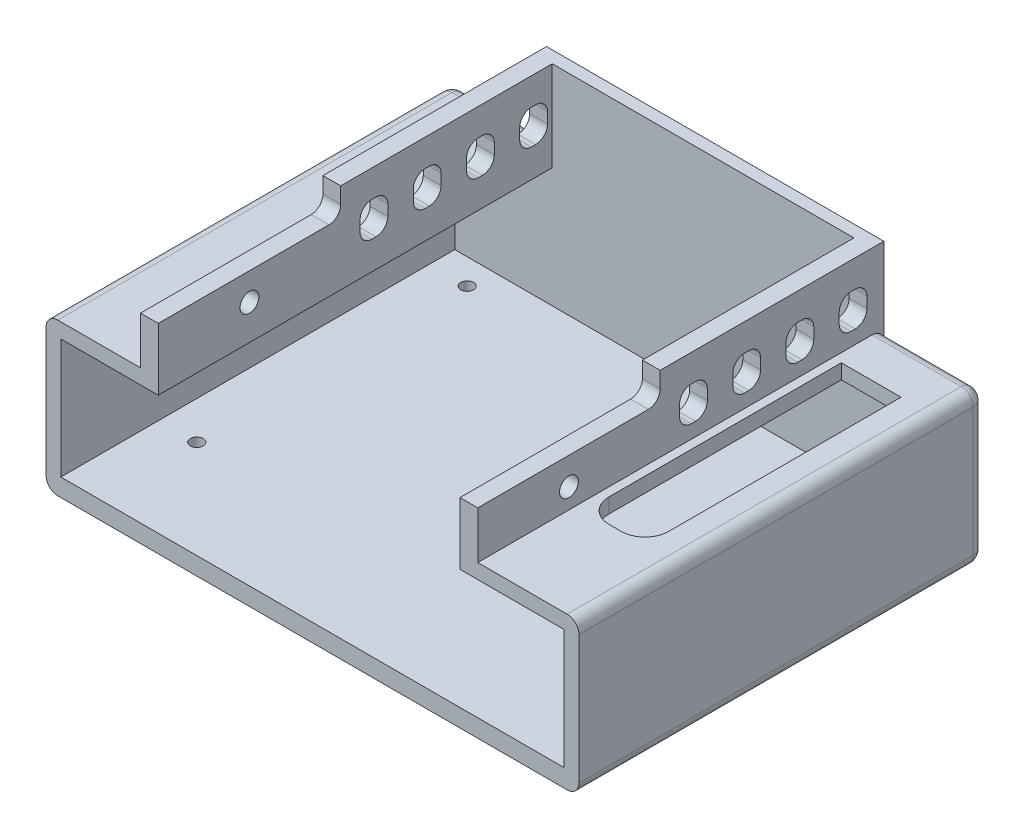
from build123d import *

# Parameters (mm, degrees)
BOSS_EXTRUDE2_DEPTH     = 25.654
BOSS_EXTRUDE4_DEPTH     = 3.175
BOSS_EXTRUDE5_DEPTH     = 16.141204421
CUT_EXTRUDE1_DEPTH      = 36.068
CUT_EXTRUDE1_DEPTH_BACK = 99.314
SKETCH8_W               = 5.954134369
SKETCH8_H               = 7.391339216
SKETCH8_3_W             = 5.954134368
SKETCH8_3_H             = 7.391339216
SKETCH8_3_W_2           = 5.954134369
CUT_EXTRUDE2_DEPTH      = 99.314
SKETCH10_W              = 114.3
SKETCH10_H              = 87.072843295
BOSS_EXTRUDE7_DEPTH     = 3.81
SKETCH11_W              = 12.814534476
SKETCH11_H              = 54.915455345
CUT_EXTRUDE4_DEPTH      = 23.368
SKETCH18_W              = 3.81
SKETCH18_H              = 39.122149616
BOSS_EXTRUDE10_DEPTH    = 10.16
CUT_EXTRUDE5_DEPTH      = 33.528
CUT_EXTRUDE5_DEPTH_BACK = 93.218
SKETCH20_R              = 2.0193
CUT_EXTRUDE7_REACH      = 108.861
SKETCH21_R              = 1.375
FILLET1_R               = 2.54
FILLET2_R               = 2.54
FILLET3_R               = 2.54
FILLET4_R               = 5.08


with BuildPart() as part:
    # Sketch1 → Boss-Extrude2 (new body)
    with BuildSketch(Plane(origin=(0, 0, 0), x_dir=(1, 0, 0), z_dir=(0, 1, 0))):
        Polygon((29.891415821, 47.667452431), (-84.408584179, 47.667452431), (-84.408584179, -39.405390864), (-81.233584179, -39.405390864), (-81.233584179, 45.081669174), (26.716415821, 45.081669174), (26.716415821, -39.405390864), (29.891415821, -39.405390864), align=None)
    extrude(amount=BOSS_EXTRUDE2_DEPTH)

    # Sketch3 → Boss-Extrude4 (add)
    with BuildSketch(Plane(origin=(0, 25.654, 0), x_dir=(1, 0, 0), z_dir=(0, 1, 0))):
        Polygon((29.891415821, 47.667452431), (-84.408584179, 47.667452431), (-84.408584179, -39.405390864), (-60.331822089, -39.405390864), (-60.331822089, 45.081669174), (4.379625861, 45.081669174), (4.379625861, -39.405390864), (29.891415821, -39.405390864), align=None)
    extrude(amount=BOSS_EXTRUDE4_DEPTH)

    # Sketch4 → Boss-Extrude5 (add)
    with BuildSketch(Plane(origin=(0, 28.829, 0), x_dir=(1, 0, 0), z_dir=(0, 1, 0))):
        Polygon((-64.141822089, -0.283241248), (-60.331822089, -0.283241248), (-60.331822089, 45.081669174), (4.379625861, 45.081669174), (4.379625861, -0.283241248), (8.189625861, -0.283241248), (8.189625861, 47.667452431), (-64.141822089, 47.667452431), align=None)
    extrude(amount=BOSS_EXTRUDE5_DEPTH)

    # Sketch8 → Cut-Extrude1 (cut, two sides: drawn at the far end of the back side and taken through both)
    with BuildSketch(Plane(origin=(8.189625861, 0, 0), x_dir=(0, 0, -1), z_dir=(1, 0, 0)).offset(-CUT_EXTRUDE1_DEPTH_BACK)):
        with Locations((18.262175985, 35.424269821)):
            Rectangle(SKETCH8_W, SKETCH8_H)
    extrude(amount=CUT_EXTRUDE1_DEPTH + CUT_EXTRUDE1_DEPTH_BACK, mode=Mode.SUBTRACT)

    # Sketch8<3> → Cut-Extrude2 (cut)
    with BuildSketch(Plane(origin=(8.189625861, 0, 0), x_dir=(0, 0, -1), z_dir=(1, 0, 0))):
        with Locations((41.087726864, 35.434837043)):
            Rectangle(SKETCH8_3_W, SKETCH8_3_H)
        with Locations((29.674951425, 35.429553432)):
            Rectangle(SKETCH8_3_W_2, SKETCH8_3_H)
        with Locations((18.262175985, 35.424269821)):
            Rectangle(SKETCH8_3_W_2, SKETCH8_3_H)
        with Locations((6.849400545, 35.41898621)):
            Rectangle(SKETCH8_3_W, SKETCH8_3_H)
    extrude(amount=-CUT_EXTRUDE2_DEPTH, mode=Mode.SUBTRACT)

    # Sketch10 → Boss-Extrude7 (add)
    with BuildSketch(Plane(origin=(0, 0, 0), x_dir=(1, 0, 0), z_dir=(0, 1, 0))):
        with Locations((-27.258584179, 4.131030783)):
            Rectangle(SKETCH10_W, SKETCH10_H)
    extrude(amount=-BOSS_EXTRUDE7_DEPTH)

    # Sketch11 → Cut-Extrude4 (cut)
    with BuildSketch(Plane(origin=(0, 6.655, 0), x_dir=(1, 0, 0), z_dir=(0, 1, 0))):
        with Locations((16.472358623, 9.22876842)):
            Rectangle(SKETCH11_W, SKETCH11_H)
    extrude(amount=CUT_EXTRUDE4_DEPTH, mode=Mode.SUBTRACT)

    # Sketch18 → Boss-Extrude10 (add)
    with BuildSketch(Plane(origin=(0, 28.829, 0), x_dir=(1, 0, 0), z_dir=(0, 1, 0))):
        with Locations((-62.236822089, -19.844316056)):
            Rectangle(SKETCH18_W, SKETCH18_H)
        with Locations((6.284625861, -19.844316056)):
            Rectangle(SKETCH18_W, SKETCH18_H)
    extrude(amount=BOSS_EXTRUDE10_DEPTH)

    # Sketch20 → Cut-Extrude5 (cut, two sides: drawn at the far end of the back side and taken through both)
    with BuildSketch(Plane(origin=(8.189625861, 0, 0), x_dir=(0, 0, -1), z_dir=(1, 0, 0)).offset(-CUT_EXTRUDE5_DEPTH_BACK)):
        with Locations((-19.844316056, 33.125886584)):
            Circle(SKETCH20_R)
    extrude(amount=CUT_EXTRUDE5_DEPTH + CUT_EXTRUDE5_DEPTH_BACK, mode=Mode.SUBTRACT)

    # Sketch21 → Cut-Extrude7 (cut, up to next)
    with BuildSketch(Plane(origin=(0, 0, 0), x_dir=(1, 0, 0), z_dir=(0, 1, 0)), mode=Mode.PRIVATE) as cut_extrude7_sk1:
        with Locations((-73.120374139, 39.635412246)):
            Circle(SKETCH21_R)
    cut_extrude7_tool1 = extrude(cut_extrude7_sk1.sketch, amount=-CUT_EXTRUDE7_REACH, mode=Mode.PRIVATE) & part.part
    # Sketch21 → Cut-Extrude7 (cut, up to next)
    with BuildSketch(Plane(origin=(0, 0, 0), x_dir=(1, 0, 0), z_dir=(0, 1, 0)), mode=Mode.PRIVATE) as cut_extrude7_sk2:
        with Locations((12.879625861, 39.635412246)):
            Circle(SKETCH21_R)
    cut_extrude7_tool2 = extrude(cut_extrude7_sk2.sketch, amount=-CUT_EXTRUDE7_REACH, mode=Mode.PRIVATE) & part.part
    # Sketch21 → Cut-Extrude7 (cut, up to next)
    with BuildSketch(Plane(origin=(0, 0, 0), x_dir=(1, 0, 0), z_dir=(0, 1, 0)), mode=Mode.PRIVATE) as cut_extrude7_sk3:
        with Locations((12.879625861, -18.364587754)):
            Circle(SKETCH21_R)
    cut_extrude7_tool3 = extrude(cut_extrude7_sk3.sketch, amount=-CUT_EXTRUDE7_REACH, mode=Mode.PRIVATE) & part.part
    # Sketch21 → Cut-Extrude7 (cut, up to next)
    with BuildSketch(Plane(origin=(0, 0, 0), x_dir=(1, 0, 0), z_dir=(0, 1, 0)), mode=Mode.PRIVATE) as cut_extrude7_sk4:
        with Locations((-73.120374139, -18.364587754)):
            Circle(SKETCH21_R)
    cut_extrude7_tool4 = extrude(cut_extrude7_sk4.sketch, amount=-CUT_EXTRUDE7_REACH, mode=Mode.PRIVATE) & part.part
    add(cut_extrude7_tool1.solids().sort_by_distance((-73.120374, 0, -39.635412))[0], mode=Mode.SUBTRACT)
    add(cut_extrude7_tool2.solids().sort_by_distance((12.879626, 0, -39.635412))[0], mode=Mode.SUBTRACT)
    add(cut_extrude7_tool3.solids().sort_by_distance((12.879626, 0, 18.364588))[0], mode=Mode.SUBTRACT)
    add(cut_extrude7_tool4.solids().sort_by_distance((-73.120374, 0, 18.364588))[0], mode=Mode.SUBTRACT)

    # Fillet1
    fillet1_edges = [part.edges().sort_by_distance(p)[0] for p in [
        (19.040520841, 28.829, -47.667452431),
        (29.891415821, 28.829, -4.131030784),
        (-84.408584179, -3.81, -4.131030784),
        (-84.408584179, 12.5095, -47.667452431),
        (29.891415821, 12.5095, -47.667452431),
        (-27.258584179, -3.81, -47.667452431),
        (29.891415821, -3.81, -4.131030784),
        (-84.408584179, 28.829, -4.131030784),
        (-74.275203134, 28.829, -47.667452431),
    ]]
    fillet(fillet1_edges, radius=FILLET1_R)

    # Fillet2
    fillet2_edges = [part.edges().sort_by_distance(p)[0] for p in [
        (-62.236822089, 39.119939429, -21.239243169),
        (-62.236822089, 31.728600213, -21.239243169),
        (-62.236822089, 31.728600213, -15.2851088),
        (-62.236822089, 39.119939429, -15.2851088),
        (-62.236822089, 31.723316602, -3.872333361),
        (-62.236822089, 39.114655818, -3.872333361),
        (-62.236822089, 39.114655818, -9.826467729),
        (-62.236822089, 31.723316602, -9.826467729),
        (-62.236822089, 31.733883824, -26.69788424),
        (-62.236822089, 39.12522304, -26.69788424),
        (-62.236822089, 39.12522304, -32.652018609),
        (-62.236822089, 31.733883824, -32.652018609),
        (-62.236822089, 31.739167435, -38.11065968),
        (-62.236822089, 39.130506651, -38.11065968),
        (-62.236822089, 39.130506651, -44.064794048),
        (-62.236822089, 31.739167435, -44.064794048),
        (6.284625861, 39.119939429, -15.2851088),
        (6.284625861, 39.119939429, -21.239243169),
        (6.284625861, 31.728600213, -21.239243169),
        (6.284625861, 31.728600213, -15.2851088),
        (6.284625861, 31.723316602, -9.826467729),
        (6.284625861, 39.114655818, -3.872333361),
        (6.284625861, 39.114655818, -9.826467729),
        (6.284625861, 31.733883824, -32.652018609),
        (6.284625861, 31.733883824, -26.69788424),
        (6.284625861, 39.12522304, -26.69788424),
        (6.284625861, 39.12522304, -32.652018609),
        (6.284625861, 39.130506651, -44.064794048),
        (6.284625861, 31.739167435, -44.064794048),
        (6.284625861, 31.739167435, -38.11065968),
        (6.284625861, 39.130506651, -38.11065968),
        (6.284625861, 31.723316602, -3.872333361),
    ]]
    fillet(fillet2_edges, radius=FILLET2_R)

    # Fillet3
    fillet3_edges = [part.edges().sort_by_distance(p)[0] for p in [
        (-62.236822089, 38.989, 0.283241248),
        (6.284625861, 38.989, 0.283241248),
    ]]
    fillet(fillet3_edges, radius=FILLET3_R)

    # Fillet4
    fillet4_edges = [part.edges().sort_by_distance(p)[0] for p in [
        (10.065091385, 27.2415, 18.228959253),
        (22.879625861, 27.2415, 18.228959253),
    ]]
    fillet(fillet4_edges, radius=FILLET4_R)


solid = part.part
